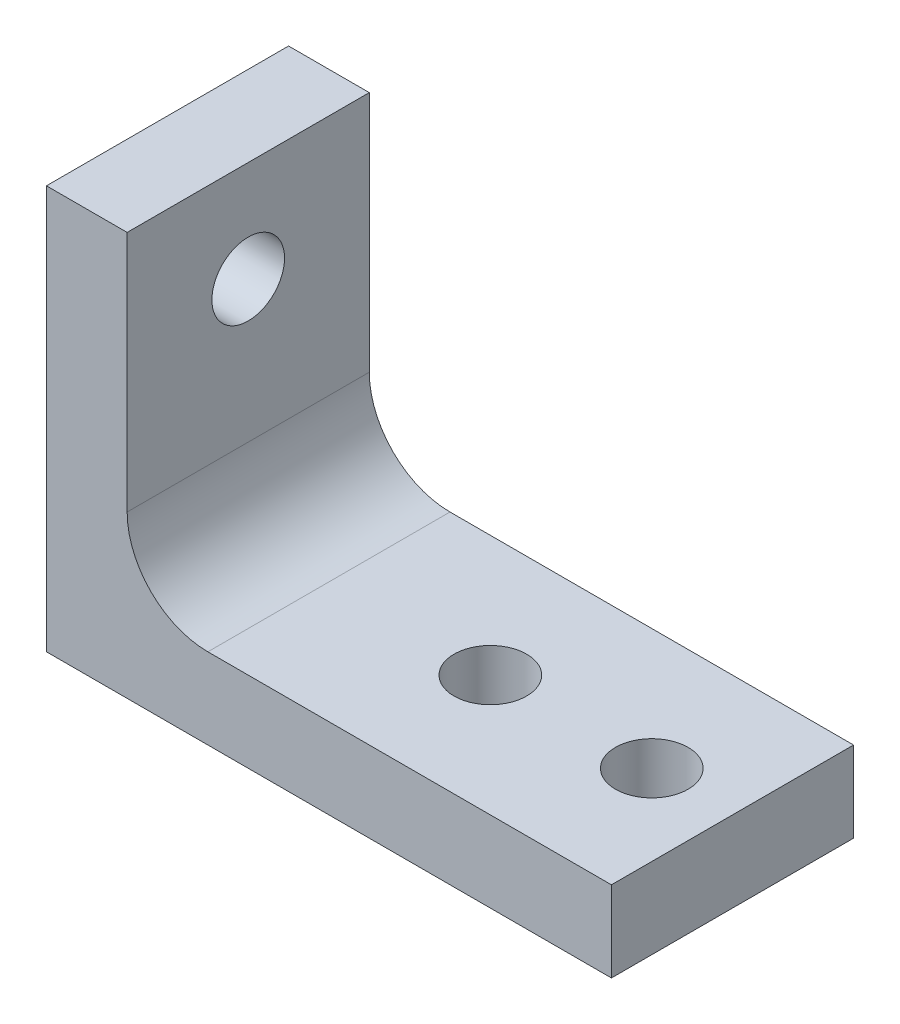
from build123d import *

# Parameters (mm, degrees)
BOSS_EXTRUDE1_DEPTH  = 30
M8_CLEARANCE_HOLE1_D = 9
M8_CLEARANCE_HOLE2_D = 9
FILLET1_R            = 10


with BuildPart() as part:
    # Sketch1 → Boss-Extrude1 (new body)
    with BuildSketch(Plane.XY):
        Polygon((0, 0), (0, 40), (-10, 40), (-10, -10), (10, -10), (60, -10), (60, 0), align=None)
    extrude(amount=BOSS_EXTRUDE1_DEPTH)

    # M8 Clearance Hole1 (through all)
    with Locations(Plane(origin=(0, 0, 0), x_dir=(0, 0, -1), z_dir=(1, 0, 0))):
        with Locations((-15, 27.5)):
            Hole(M8_CLEARANCE_HOLE1_D / 2)

    # M8 Clearance Hole2 (through all)
    with Locations(Plane(origin=(0, 0, 0), x_dir=(1, 0, 0), z_dir=(0, 1, 0))):
        with Locations((30, -15), (50, -15)):
            Hole(M8_CLEARANCE_HOLE2_D / 2)

    # Fillet1
    fillet1_edges = [part.edges().sort_by_distance(p)[0] for p in [
        (0, 0, 15),
    ]]
    fillet(fillet1_edges, radius=FILLET1_R)


solid = part.part
